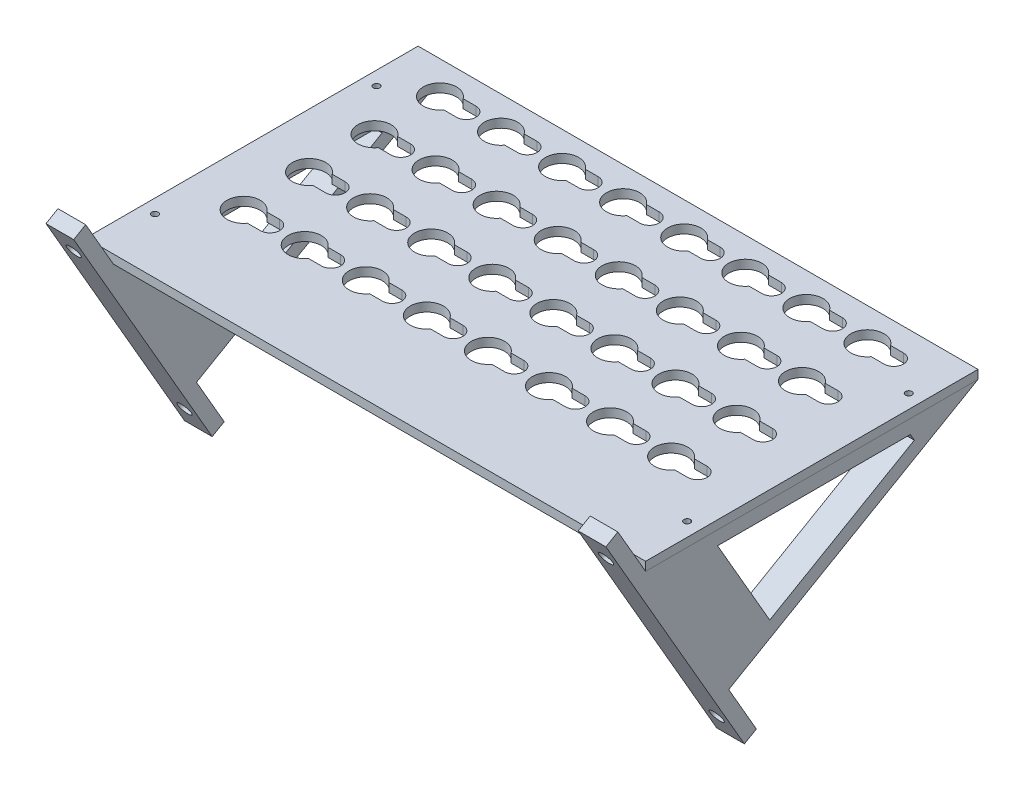
from build123d import *

# Parameters (mm, degrees)
SKETCH1_W                            = 256.7
SKETCH1_H                            = 152.4
SKETCH1_R                            = 1.4732
BOSS_EXTRUDE1_DEPTH                  = 4
BOSS_EXTRUDE2_DEPTH                  = 12.7
BOSS_EXTRUDE3_START                  = 256.7
BOSS_EXTRUDE3_DEPTH                  = 12.7
SKETCH3_W                            = 3.175
SKETCH3_H                            = 61.34261314
F_1_4_0_25_DIAMETER_HOLE1_AT_2_COUNT = 2
F_1_4_0_25_DIAMETER_HOLE1_AT_2_PITCH = 244
F_1_4_0_25_DIAMETER_HOLE1_AT_3_COUNT = 2
F_1_4_0_25_DIAMETER_HOLE1_AT_3_PITCH = 264.307699472
F_1_4_0_25_DIAMETER_HOLE1_AT_4_COUNT = 2
F_1_4_0_25_DIAMETER_HOLE1_AT_4_PITCH = 101.6


with BuildPart() as part:
    # Sketch1 → Boss-Extrude1 (new body)
    with BuildSketch(Plane(origin=(0, 0, 0), x_dir=(1, 0, 0), z_dir=(0, 1, 0))):
        with Locations((128.35, -76.2)):
            Rectangle(SKETCH1_W, SKETCH1_H)
        with Locations(Location((6.35, -127, 0), (0, 0, 270))):
            Circle(SKETCH1_R, mode=Mode.SUBTRACT)
        with BuildLine():
            ThreePointArc((31.189214409, -109.445), (17.38, -105), (31.189214409, -100.555))
            Line((31.189214409, -100.555), (37.065, -100.555))
            ThreePointArc((37.065, -100.555), (40.208089642, -101.856910358), (41.51, -105))
            ThreePointArc((41.51, -105), (40.208089642, -108.143089642), (37.065, -109.445))
            Line((37.065, -109.445), (31.189214409, -109.445))
        make_face(mode=Mode.SUBTRACT)
        with BuildLine():
            ThreePointArc((59.189214409, -109.445), (45.38, -105), (59.189214409, -100.555))
            Line((59.189214409, -100.555), (65.065, -100.555))
            ThreePointArc((65.065, -100.555), (68.208089642, -101.856910358), (69.51, -105))
            ThreePointArc((69.51, -105), (68.208089642, -108.143089642), (65.065, -109.445))
            Line((65.065, -109.445), (59.189214409, -109.445))
        make_face(mode=Mode.SUBTRACT)
        with BuildLine():
            ThreePointArc((87.189214409, -109.445), (73.38, -105), (87.189214409, -100.555))
            Line((87.189214409, -100.555), (93.065, -100.555))
            ThreePointArc((93.065, -100.555), (96.208089642, -101.856910358), (97.51, -105))
            ThreePointArc((97.51, -105), (96.208089642, -108.143089642), (93.065, -109.445))
            Line((93.065, -109.445), (87.189214409, -109.445))
        make_face(mode=Mode.SUBTRACT)
        with BuildLine():
            ThreePointArc((115.189214409, -109.445), (101.38, -105), (115.189214409, -100.555))
            Line((115.189214409, -100.555), (121.065, -100.555))
            ThreePointArc((121.065, -100.555), (124.208089642, -101.856910358), (125.51, -105))
            ThreePointArc((125.51, -105), (124.208089642, -108.143089642), (121.065, -109.445))
            Line((121.065, -109.445), (115.189214409, -109.445))
        make_face(mode=Mode.SUBTRACT)
        with Locations(Location((250.35, -127, 0), (0, 0, 270))):
            Circle(SKETCH1_R, mode=Mode.SUBTRACT)
        with BuildLine():
            ThreePointArc((143.189214409, -109.445), (129.38, -105), (143.189214409, -100.555))
            Line((143.189214409, -100.555), (149.065, -100.555))
            ThreePointArc((149.065, -100.555), (152.208089642, -101.856910358), (153.51, -105))
            ThreePointArc((153.51, -105), (152.208089642, -108.143089642), (149.065, -109.445))
            Line((149.065, -109.445), (143.189214409, -109.445))
        make_face(mode=Mode.SUBTRACT)
        with BuildLine():
            ThreePointArc((171.189214409, -109.445), (157.38, -105), (171.189214409, -100.555))
            Line((171.189214409, -100.555), (177.065, -100.555))
            ThreePointArc((177.065, -100.555), (180.208089642, -101.856910358), (181.51, -105))
            ThreePointArc((181.51, -105), (180.208089642, -108.143089642), (177.065, -109.445))
            Line((177.065, -109.445), (171.189214409, -109.445))
        make_face(mode=Mode.SUBTRACT)
        with BuildLine():
            ThreePointArc((199.189214409, -109.445), (185.38, -105), (199.189214409, -100.555))
            Line((199.189214409, -100.555), (205.065, -100.555))
            ThreePointArc((205.065, -100.555), (208.208089642, -101.856910358), (209.51, -105))
            ThreePointArc((209.51, -105), (208.208089642, -108.143089642), (205.065, -109.445))
            Line((205.065, -109.445), (199.189214409, -109.445))
        make_face(mode=Mode.SUBTRACT)
        with BuildLine():
            ThreePointArc((227.189214409, -109.445), (213.38, -105), (227.189214409, -100.555))
            Line((227.189214409, -100.555), (233.065, -100.555))
            ThreePointArc((233.065, -100.555), (236.208089642, -101.856910358), (237.51, -105))
            ThreePointArc((237.51, -105), (236.208089642, -108.143089642), (233.065, -109.445))
            Line((233.065, -109.445), (227.189214409, -109.445))
        make_face(mode=Mode.SUBTRACT)
        with BuildLine():
            ThreePointArc((31.189214409, -79.445), (17.38, -75), (31.189214409, -70.555))
            Line((31.189214409, -70.555), (37.065, -70.555))
            ThreePointArc((37.065, -70.555), (40.208089642, -71.856910358), (41.51, -75))
            ThreePointArc((41.51, -75), (40.208089642, -78.143089642), (37.065, -79.445))
            Line((37.065, -79.445), (31.189214409, -79.445))
        make_face(mode=Mode.SUBTRACT)
        with BuildLine():
            ThreePointArc((59.189214409, -79.445), (45.38, -75), (59.189214409, -70.555))
            Line((59.189214409, -70.555), (65.065, -70.555))
            ThreePointArc((65.065, -70.555), (68.208089642, -71.856910358), (69.51, -75))
            ThreePointArc((69.51, -75), (68.208089642, -78.143089642), (65.065, -79.445))
            Line((65.065, -79.445), (59.189214409, -79.445))
        make_face(mode=Mode.SUBTRACT)
        with BuildLine():
            ThreePointArc((31.189214409, -49.445), (17.38, -45), (31.189214409, -40.555))
            Line((31.189214409, -40.555), (37.065, -40.555))
            ThreePointArc((37.065, -40.555), (40.208089642, -41.856910358), (41.51, -45))
            ThreePointArc((41.51, -45), (40.208089642, -48.143089642), (37.065, -49.445))
            Line((37.065, -49.445), (31.189214409, -49.445))
        make_face(mode=Mode.SUBTRACT)
        with BuildLine():
            ThreePointArc((59.189214409, -49.445), (45.38, -45), (59.189214409, -40.555))
            Line((59.189214409, -40.555), (65.065, -40.555))
            ThreePointArc((65.065, -40.555), (68.208089642, -41.856910358), (69.51, -45))
            ThreePointArc((69.51, -45), (68.208089642, -48.143089642), (65.065, -49.445))
            Line((65.065, -49.445), (59.189214409, -49.445))
        make_face(mode=Mode.SUBTRACT)
        with BuildLine():
            ThreePointArc((87.189214409, -79.445), (73.38, -75), (87.189214409, -70.555))
            Line((87.189214409, -70.555), (93.065, -70.555))
            ThreePointArc((93.065, -70.555), (96.208089642, -71.856910358), (97.51, -75))
            ThreePointArc((97.51, -75), (96.208089642, -78.143089642), (93.065, -79.445))
            Line((93.065, -79.445), (87.189214409, -79.445))
        make_face(mode=Mode.SUBTRACT)
        with BuildLine():
            ThreePointArc((115.189214409, -79.445), (101.38, -75), (115.189214409, -70.555))
            Line((115.189214409, -70.555), (121.065, -70.555))
            ThreePointArc((121.065, -70.555), (124.208089642, -71.856910358), (125.51, -75))
            ThreePointArc((125.51, -75), (124.208089642, -78.143089642), (121.065, -79.445))
            Line((121.065, -79.445), (115.189214409, -79.445))
        make_face(mode=Mode.SUBTRACT)
        with BuildLine():
            ThreePointArc((87.189214409, -49.445), (73.38, -45), (87.189214409, -40.555))
            Line((87.189214409, -40.555), (93.065, -40.555))
            ThreePointArc((93.065, -40.555), (96.208089642, -41.856910358), (97.51, -45))
            ThreePointArc((97.51, -45), (96.208089642, -48.143089642), (93.065, -49.445))
            Line((93.065, -49.445), (87.189214409, -49.445))
        make_face(mode=Mode.SUBTRACT)
        with BuildLine():
            ThreePointArc((115.189214409, -49.445), (101.38, -45), (115.189214409, -40.555))
            Line((115.189214409, -40.555), (121.065, -40.555))
            ThreePointArc((121.065, -40.555), (124.208089642, -41.856910358), (125.51, -45))
            ThreePointArc((125.51, -45), (124.208089642, -48.143089642), (121.065, -49.445))
            Line((121.065, -49.445), (115.189214409, -49.445))
        make_face(mode=Mode.SUBTRACT)
        with Locations(Location((6.35, -25.4, 0), (0, 0, 270))):
            Circle(SKETCH1_R, mode=Mode.SUBTRACT)
        with BuildLine():
            ThreePointArc((31.189214409, -19.445), (17.38, -15), (31.189214409, -10.555))
            Line((31.189214409, -10.555), (37.065, -10.555))
            ThreePointArc((37.065, -10.555), (40.208089642, -11.856910358), (41.51, -15))
            ThreePointArc((41.51, -15), (40.208089642, -18.143089642), (37.065, -19.445))
            Line((37.065, -19.445), (31.189214409, -19.445))
        make_face(mode=Mode.SUBTRACT)
        with BuildLine():
            ThreePointArc((59.189214409, -19.445), (45.38, -15), (59.189214409, -10.555))
            Line((59.189214409, -10.555), (65.065, -10.555))
            ThreePointArc((65.065, -10.555), (68.208089642, -11.856910358), (69.51, -15))
            ThreePointArc((69.51, -15), (68.208089642, -18.143089642), (65.065, -19.445))
            Line((65.065, -19.445), (59.189214409, -19.445))
        make_face(mode=Mode.SUBTRACT)
        with BuildLine():
            ThreePointArc((87.189214409, -19.445), (73.38, -15), (87.189214409, -10.555))
            Line((87.189214409, -10.555), (93.065, -10.555))
            ThreePointArc((93.065, -10.555), (96.208089642, -11.856910358), (97.51, -15))
            ThreePointArc((97.51, -15), (96.208089642, -18.143089642), (93.065, -19.445))
            Line((93.065, -19.445), (87.189214409, -19.445))
        make_face(mode=Mode.SUBTRACT)
        with BuildLine():
            ThreePointArc((115.189214409, -19.445), (101.38, -15), (115.189214409, -10.555))
            Line((115.189214409, -10.555), (121.065, -10.555))
            ThreePointArc((121.065, -10.555), (124.208089642, -11.856910358), (125.51, -15))
            ThreePointArc((125.51, -15), (124.208089642, -18.143089642), (121.065, -19.445))
            Line((121.065, -19.445), (115.189214409, -19.445))
        make_face(mode=Mode.SUBTRACT)
        with BuildLine():
            ThreePointArc((143.189214409, -79.445), (129.38, -75), (143.189214409, -70.555))
            Line((143.189214409, -70.555), (149.065, -70.555))
            ThreePointArc((149.065, -70.555), (152.208089642, -71.856910358), (153.51, -75))
            ThreePointArc((153.51, -75), (152.208089642, -78.143089642), (149.065, -79.445))
            Line((149.065, -79.445), (143.189214409, -79.445))
        make_face(mode=Mode.SUBTRACT)
        with BuildLine():
            ThreePointArc((171.189214409, -79.445), (157.38, -75), (171.189214409, -70.555))
            Line((171.189214409, -70.555), (177.065, -70.555))
            ThreePointArc((177.065, -70.555), (180.208089642, -71.856910358), (181.51, -75))
            ThreePointArc((181.51, -75), (180.208089642, -78.143089642), (177.065, -79.445))
            Line((177.065, -79.445), (171.189214409, -79.445))
        make_face(mode=Mode.SUBTRACT)
        with BuildLine():
            ThreePointArc((143.189214409, -49.445), (129.38, -45), (143.189214409, -40.555))
            Line((143.189214409, -40.555), (149.065, -40.555))
            ThreePointArc((149.065, -40.555), (152.208089642, -41.856910358), (153.51, -45))
            ThreePointArc((153.51, -45), (152.208089642, -48.143089642), (149.065, -49.445))
            Line((149.065, -49.445), (143.189214409, -49.445))
        make_face(mode=Mode.SUBTRACT)
        with BuildLine():
            ThreePointArc((171.189214409, -49.445), (157.38, -45), (171.189214409, -40.555))
            Line((171.189214409, -40.555), (177.065, -40.555))
            ThreePointArc((177.065, -40.555), (180.208089642, -41.856910358), (181.51, -45))
            ThreePointArc((181.51, -45), (180.208089642, -48.143089642), (177.065, -49.445))
            Line((177.065, -49.445), (171.189214409, -49.445))
        make_face(mode=Mode.SUBTRACT)
        with BuildLine():
            ThreePointArc((199.189214409, -79.445), (185.38, -75), (199.189214409, -70.555))
            Line((199.189214409, -70.555), (205.065, -70.555))
            ThreePointArc((205.065, -70.555), (208.208089642, -71.856910358), (209.51, -75))
            ThreePointArc((209.51, -75), (208.208089642, -78.143089642), (205.065, -79.445))
            Line((205.065, -79.445), (199.189214409, -79.445))
        make_face(mode=Mode.SUBTRACT)
        with BuildLine():
            ThreePointArc((227.189214409, -79.445), (213.38, -75), (227.189214409, -70.555))
            Line((227.189214409, -70.555), (233.065, -70.555))
            ThreePointArc((233.065, -70.555), (236.208089642, -71.856910358), (237.51, -75))
            ThreePointArc((237.51, -75), (236.208089642, -78.143089642), (233.065, -79.445))
            Line((233.065, -79.445), (227.189214409, -79.445))
        make_face(mode=Mode.SUBTRACT)
        with BuildLine():
            ThreePointArc((199.189214409, -49.445), (185.38, -45), (199.189214409, -40.555))
            Line((199.189214409, -40.555), (205.065, -40.555))
            ThreePointArc((205.065, -40.555), (208.208089642, -41.856910358), (209.51, -45))
            ThreePointArc((209.51, -45), (208.208089642, -48.143089642), (205.065, -49.445))
            Line((205.065, -49.445), (199.189214409, -49.445))
        make_face(mode=Mode.SUBTRACT)
        with BuildLine():
            ThreePointArc((227.189214409, -49.445), (213.38, -45), (227.189214409, -40.555))
            Line((227.189214409, -40.555), (233.065, -40.555))
            ThreePointArc((233.065, -40.555), (236.208089642, -41.856910358), (237.51, -45))
            ThreePointArc((237.51, -45), (236.208089642, -48.143089642), (233.065, -49.445))
            Line((233.065, -49.445), (227.189214409, -49.445))
        make_face(mode=Mode.SUBTRACT)
        with BuildLine():
            ThreePointArc((143.189214409, -19.445), (129.38, -15), (143.189214409, -10.555))
            Line((143.189214409, -10.555), (149.065, -10.555))
            ThreePointArc((149.065, -10.555), (152.208089642, -11.856910358), (153.51, -15))
            ThreePointArc((153.51, -15), (152.208089642, -18.143089642), (149.065, -19.445))
            Line((149.065, -19.445), (143.189214409, -19.445))
        make_face(mode=Mode.SUBTRACT)
        with BuildLine():
            ThreePointArc((171.189214409, -19.445), (157.38, -15), (171.189214409, -10.555))
            Line((171.189214409, -10.555), (177.065, -10.555))
            ThreePointArc((177.065, -10.555), (180.208089642, -11.856910358), (181.51, -15))
            ThreePointArc((181.51, -15), (180.208089642, -18.143089642), (177.065, -19.445))
            Line((177.065, -19.445), (171.189214409, -19.445))
        make_face(mode=Mode.SUBTRACT)
        with Locations(Location((250.35, -25.4, 0), (0, 0, 270))):
            Circle(SKETCH1_R, mode=Mode.SUBTRACT)
        with BuildLine():
            ThreePointArc((199.189214409, -19.445), (185.38, -15), (199.189214409, -10.555))
            Line((199.189214409, -10.555), (205.065, -10.555))
            ThreePointArc((205.065, -10.555), (208.208089642, -11.856910358), (209.51, -15))
            ThreePointArc((209.51, -15), (208.208089642, -18.143089642), (205.065, -19.445))
            Line((205.065, -19.445), (199.189214409, -19.445))
        make_face(mode=Mode.SUBTRACT)
        with BuildLine():
            ThreePointArc((227.189214409, -19.445), (213.38, -15), (227.189214409, -10.555))
            Line((227.189214409, -10.555), (233.065, -10.555))
            ThreePointArc((233.065, -10.555), (236.208089642, -11.856910358), (237.51, -15))
            ThreePointArc((237.51, -15), (236.208089642, -18.143089642), (233.065, -19.445))
            Line((233.065, -19.445), (227.189214409, -19.445))
        make_face(mode=Mode.SUBTRACT)
    extrude(amount=BOSS_EXTRUDE1_DEPTH)


with BuildPart() as body_2:
    # Sketch2 → Boss-Extrude2 (new body)
    # profile 1 of 4: a face of its own
    with BuildSketch(Plane(origin=(0, 0, 0), x_dir=(0, 0, -1), z_dir=(1, 0, 0))):
        Polygon((-114.3, -65.991135768), (0, 0), (-152.4, 0), align=None)
        Polygon((-95.477954744, -47.791874454), (-119.404432116, -6.35), (-31.030871047, -6.35), (-29.197783942, -9.525), align=None, mode=Mode.SUBTRACT)
    # profile 2 of 4: a face of its own
    with BuildSketch(Plane(origin=(0, 0, 0), x_dir=(0, 0, -1), z_dir=(1, 0, 0))):
        Polygon((-119.799261314, -69.166135768), (-114.3, -65.991135768), (-152.4, 0), (-157.899261314, -3.175), align=None)
    # profile 3 of 4: a face of its own
    with BuildSketch(Plane(origin=(0, 0, 0), x_dir=(0, 0, -1), z_dir=(1, 0, 0))):
        Polygon((-101.6, -87.988181024), (-114.3, -65.991135768), (-119.799261314, -69.166135768), (-107.099261314, -91.163181024), align=None)
    # profile 4 of 4: a face of its own
    with BuildSketch(Plane(origin=(0, 0, 0), x_dir=(0, 0, -1), z_dir=(1, 0, 0))):
        Polygon((-157.899261314, -3.175), (-152.4, 0), (-165.1, 21.997045256), (-170.599261314, 18.822045256), align=None)
    extrude(amount=BOSS_EXTRUDE2_DEPTH)

    # Sketch3 → 1/4 (0.25) Diameter Hole1 (revolve, cut)
    with BuildSketch(Plane(origin=(6.35, -76.989658396, 107.95), x_dir=(0, 0.8660254037844362, 0.5000000000000043), z_dir=(1, 0, 0))):
        with Locations((1.5875, 30.67130657)):
            Rectangle(SKETCH3_W, SKETCH3_H)
    f_1_4_0_25_diameter_hole1 = revolve(axis=Axis((6.35, -73.814658396, 102.450738686), (0, -0.5000000000000044, 0.8660254037844362)), mode=Mode.SUBTRACT)

    # 1/4 (0.25) Diameter Hole1 at 4: 1/4 (0.25) Diameter Hole1 ×2
    with Locations(*[Vector(0, 0.8660254037844362, 0.5000000000000044) * (i * F_1_4_0_25_DIAMETER_HOLE1_AT_4_PITCH) for i in range(1, F_1_4_0_25_DIAMETER_HOLE1_AT_4_COUNT)]):
        add(f_1_4_0_25_diameter_hole1, mode=Mode.SUBTRACT)


with BuildPart() as body_3:
    # Sketch2<3> → Boss-Extrude3 (new body)
    # profile 1 of 4: a face of its own
    with BuildSketch(Plane(origin=(0, 0, 0), x_dir=(0, 0, -1), z_dir=(1, 0, 0)).offset(BOSS_EXTRUDE3_START)):
        Polygon((-114.3, -65.991135768), (0, 0), (-152.4, 0), align=None)
        Polygon((-95.477954744, -47.791874454), (-119.404432116, -6.35), (-31.030871047, -6.35), (-29.197783942, -9.525), align=None, mode=Mode.SUBTRACT)
    # profile 2 of 4: a face of its own
    with BuildSketch(Plane(origin=(0, 0, 0), x_dir=(0, 0, -1), z_dir=(1, 0, 0)).offset(BOSS_EXTRUDE3_START)):
        Polygon((-119.799261314, -69.166135768), (-114.3, -65.991135768), (-152.4, 0), (-157.899261314, -3.175), align=None)
    # profile 3 of 4: a face of its own
    with BuildSketch(Plane(origin=(0, 0, 0), x_dir=(0, 0, -1), z_dir=(1, 0, 0)).offset(BOSS_EXTRUDE3_START)):
        Polygon((-101.6, -87.988181024), (-114.3, -65.991135768), (-119.799261314, -69.166135768), (-107.099261314, -91.163181024), align=None)
    # profile 4 of 4: a face of its own
    with BuildSketch(Plane(origin=(0, 0, 0), x_dir=(0, 0, -1), z_dir=(1, 0, 0)).offset(BOSS_EXTRUDE3_START)):
        Polygon((-157.899261314, -3.175), (-152.4, 0), (-165.1, 21.997045256), (-170.599261314, 18.822045256), align=None)
    extrude(amount=-BOSS_EXTRUDE3_DEPTH)

    # 1/4 (0.25) Diameter Hole1 at 2: 1/4 (0.25) Diameter Hole1 ×2
    with Locations(*[(i * F_1_4_0_25_DIAMETER_HOLE1_AT_2_PITCH, 0, 0) for i in range(1, F_1_4_0_25_DIAMETER_HOLE1_AT_2_COUNT)]):
        add(f_1_4_0_25_diameter_hole1, mode=Mode.SUBTRACT)

    # 1/4 (0.25) Diameter Hole1 at 3: 1/4 (0.25) Diameter Hole1 ×2
    with Locations(*[Vector(0.9231664476205125, 0.3329005594630207, 0.1922002276193543) * (i * F_1_4_0_25_DIAMETER_HOLE1_AT_3_PITCH) for i in range(1, F_1_4_0_25_DIAMETER_HOLE1_AT_3_COUNT)]):
        add(f_1_4_0_25_diameter_hole1, mode=Mode.SUBTRACT)


solid = Compound([part.part, body_2.part, body_3.part])
